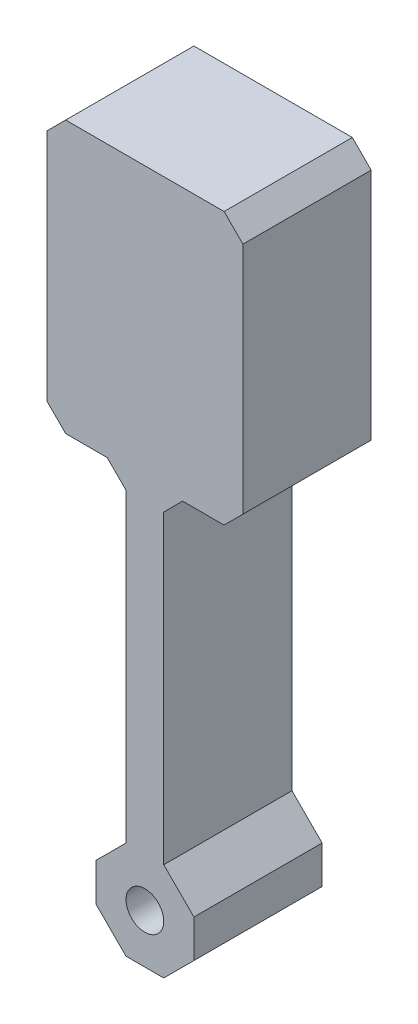
from build123d import *

# Parameters (mm, degrees)
SKETCH1_W           = 26
SKETCH1_H           = 26
SKETCH1_W_2         = 5
SKETCH1_H_2         = 43
SKETCH1_R           = 2.5
BOSS_EXTRUDE1_DEPTH = 17
CHAMFER1_SIZE       = 2.5


with BuildPart() as part:
    # Sketch1 → Boss-Extrude1 (new body)
    # profile 1 of 4: a face of its own
    with BuildSketch(Plane.XY):
        Rectangle(SKETCH1_W, SKETCH1_H)
    # profile 2 of 4: a face of its own
    with BuildSketch(Plane.XY):
        Polygon((-2.5, -23), (2.5, -23), (13, -23), (13, -13), (-13, -13), (-13, -23), align=None)
    # profile 3 of 4: a face of its own
    with BuildSketch(Plane.XY):
        with Locations((0, -44.5)):
            Rectangle(SKETCH1_W_2, SKETCH1_H_2)
    # profile 4 of 4: a face of its own
    with BuildSketch(Plane.XY):
        Polygon((6.5, -70), (6.5, -75), (2.5, -79), (-2.5, -79), (-6.5, -75), (-6.5, -70), (-2.5, -66), (2.5, -66), align=None)
        with Locations((0, -72.5)):
            Circle(SKETCH1_R, mode=Mode.SUBTRACT)
    extrude(amount=BOSS_EXTRUDE1_DEPTH)

    # Chamfer1
    chamfer1_edges = [part.edges().sort_by_distance(p)[0] for p in [
        (-13, 13, 8.5),
        (13, 13, 8.5),
        (13, -23, 8.5),
        (2.5, -23, 8.5),
        (-2.5, -23, 8.5),
        (-13, -23, 8.5),
    ]]
    chamfer(chamfer1_edges, length=CHAMFER1_SIZE)


solid = part.part
